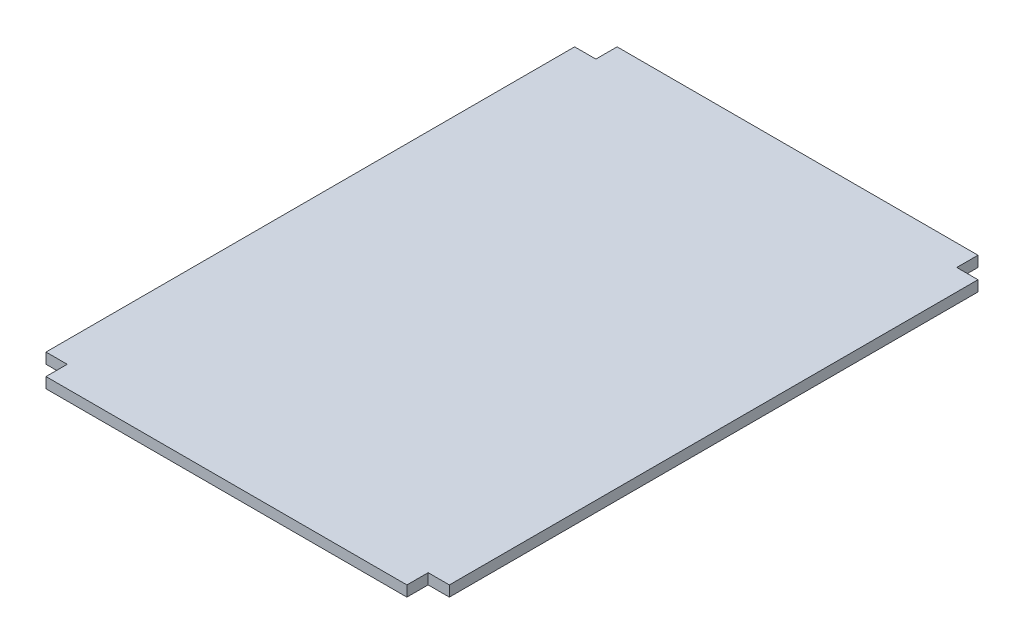
from build123d import *

# Parameters (mm, degrees)
BOSS_EXTRUDE1_DEPTH = 12.7


with BuildPart() as part:
    # Sketch1 → Boss-Extrude1 (new body)
    with BuildSketch(Plane(origin=(0, 0, 0), x_dir=(1, 0, 0), z_dir=(0, 1, 0))):
        Polygon((-215.9, -316.23), (-215.9, -341.63), (215.9, -341.63), (215.9, -316.23), (241.3, -316.23), (241.3, 316.23), (215.9, 316.23), (215.9, 341.63), (-215.9, 341.63), (-215.9, 316.23), (-241.3, 316.23), (-241.3, -316.23), align=None)
    extrude(amount=BOSS_EXTRUDE1_DEPTH)


solid = part.part
